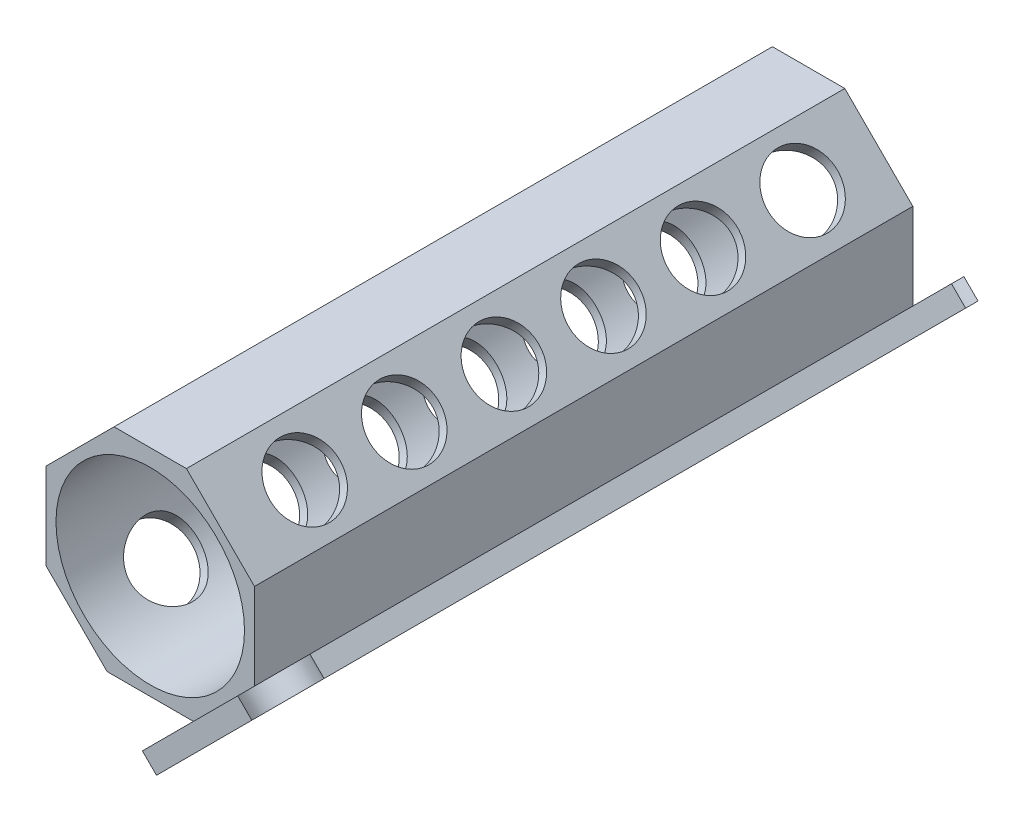
from build123d import *

# Parameters (mm, degrees)
SKIZZE1_R                        = 9.45
AUFSATZ_LINEAR_AUSTRAGEN1_DEPTH  = 66
SKIZZE9_R                        = 3.5
SCHNITT_LINEAR_AUSTRAGEN8_DEPTH  = 71.657475281
SKIZZE13_W                       = 22
SKIZZE13_H                       = 72.8
AUFSATZ_LINEAR_AUSTRAGEN2_DEPTH  = 2
SKIZZE14_R                       = 3
SCHNITT_LINEAR_AUSTRAGEN12_DEPTH = 2


with BuildPart() as part:
    # Skizze1 → Aufsatz-Linear austragen1 (new body)
    with BuildSketch(Plane(origin=(0, 0, 0), x_dir=(0, 1, 0), z_dir=(0, 0, 1))):
        Polygon((11.150811659, 3.627720068), (11.150811659, -3.627720068), (4.328531727, -10.45), (-4.328531727, -10.45), (-10.45, -4.328531727), (-10.45, 4.328531727), (-4.328531727, 10.45), (4.328531727, 10.45), align=None)
        with Locations(Location((0, 0, 0), (0, 0, 270))):
            Circle(SKIZZE1_R, mode=Mode.SUBTRACT)
    extrude(amount=AUFSATZ_LINEAR_AUSTRAGEN1_DEPTH)

    # Skizze9 → Schnitt-Linear austragen8 (cut, through all)
    with BuildSketch(Plane(origin=(7.389265863, 7.389265863, 0), x_dir=(-0.7071067811865476, 0.7071067811865475, 0), z_dir=(0.7071067811865475, 0.7071067811865476, 0))):
        with Locations((0.432478845, 57.6)):
            Circle(SKIZZE9_R)
        with Locations((0.456584688, 47.600029055)):
            Circle(SKIZZE9_R)
        with Locations((0.480690531, 37.600058109)):
            Circle(SKIZZE9_R)
        with Locations((0.504796374, 27.600087164)):
            Circle(SKIZZE9_R)
        with Locations((0.528902217, 17.600116219)):
            Circle(SKIZZE9_R)
        with Locations((0.553008059, 7.600145273)):
            Circle(SKIZZE9_R)
    extrude(amount=-SCHNITT_LINEAR_AUSTRAGEN8_DEPTH, mode=Mode.SUBTRACT)

    # Skizze13 → Aufsatz-Linear austragen2 (add)
    with BuildSketch(Plane(origin=(7.389265863, -7.389265863, 0), x_dir=(0.7071067811865477, 0.7071067811865475, 0), z_dir=(0.7071067811865475, -0.7071067811865477, 0))):
        with Locations((0, 33)):
            Rectangle(SKIZZE13_W, SKIZZE13_H)
    extrude(amount=AUFSATZ_LINEAR_AUSTRAGEN2_DEPTH)

    # Skizze14 → Schnitt-Linear austragen12 (cut)
    with BuildSketch(Plane(origin=(8.803479426, -8.803479426, 0), x_dir=(0.7071067811865478, 0.7071067811865474, 0), z_dir=(0.7071067811865474, -0.7071067811865478, 0))):
        with Locations((8.88, 67.28)):
            Circle(SKIZZE14_R)
        with Locations((-8.88, -1.28)):
            Circle(SKIZZE14_R)
        with Locations((8.88, -1.28)):
            Circle(SKIZZE14_R)
        with Locations((-8.88, 67.28)):
            Circle(SKIZZE14_R)
    extrude(amount=-SCHNITT_LINEAR_AUSTRAGEN12_DEPTH, mode=Mode.SUBTRACT)


solid = part.part
